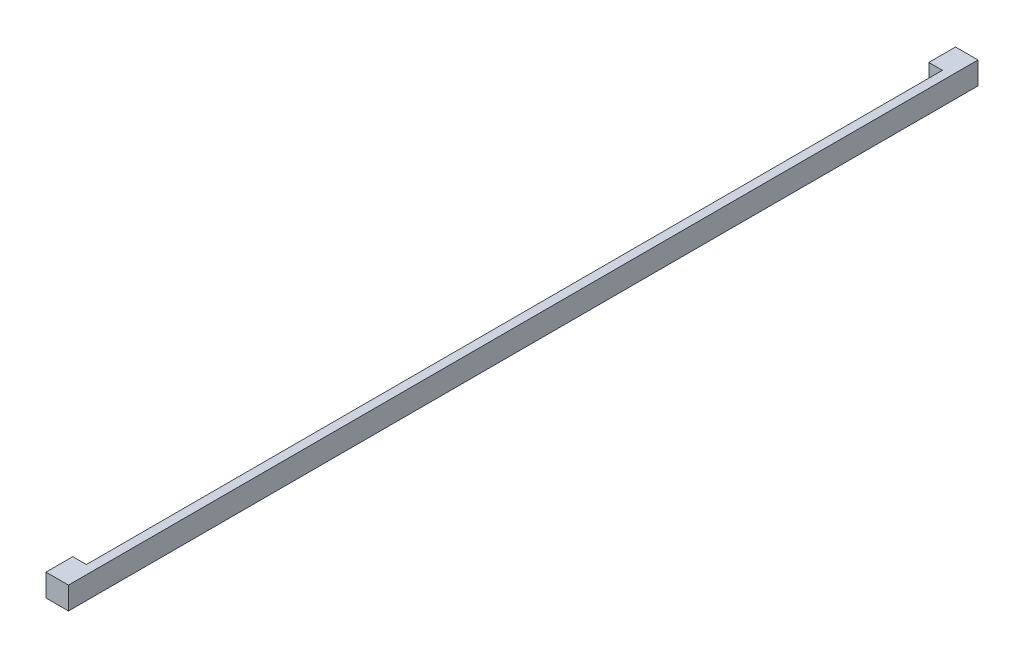
from build123d import *

# Parameters (mm, degrees)
SKETCH_1_W          = 8.4
SKETCH_1_H          = 8.4
EXTRUDE_1_DEPTH     = 340
SKETCH_3_W          = 15.760097013
SKETCH_3_H          = 320
CUT_EXTRUDE_1_DEPTH = 5.1


with BuildPart() as part:
    # Эскиз1 → Бобышка-Вытянуть1 (new body)
    with BuildSketch(Plane.XY):
        Rectangle(SKETCH_1_W, SKETCH_1_H)
    extrude(amount=EXTRUDE_1_DEPTH)

    # Эскиз3 → Вырез-Вытянуть1 (cut)
    with BuildSketch(Plane(origin=(0, 4.2, 0), x_dir=(1, 0, 0), z_dir=(0, 1, 0))):
        with Locations((-6.980048507, -170)):
            Rectangle(SKETCH_3_W, SKETCH_3_H)
    extrude(amount=-CUT_EXTRUDE_1_DEPTH, mode=Mode.SUBTRACT)


solid = part.part
